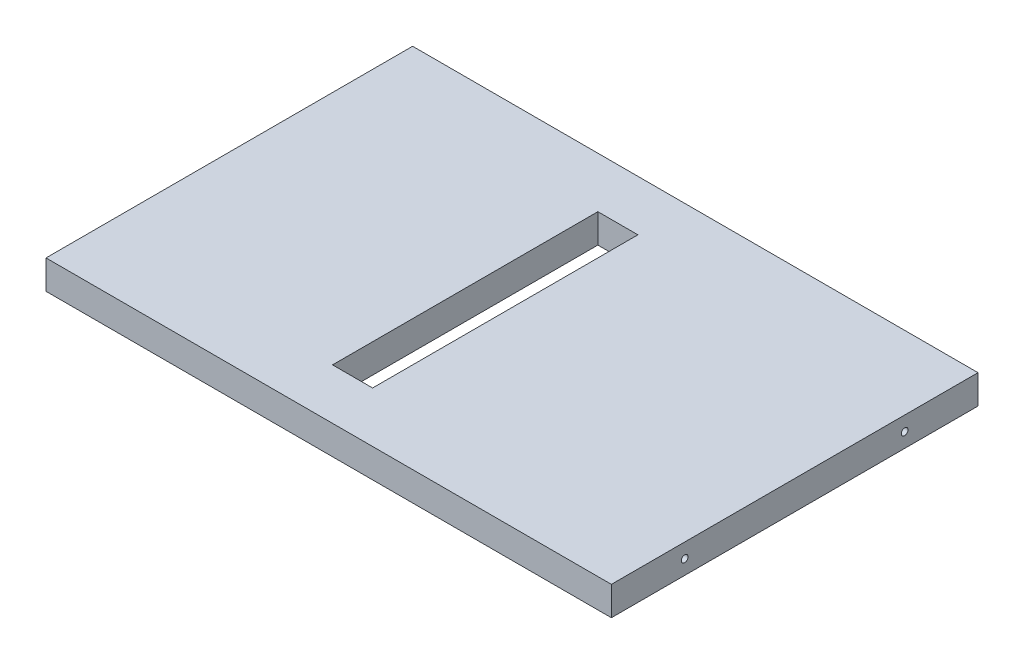
from build123d import *

# Parameters (mm, degrees)
SKETCH_1_W          = 58.6
SKETCH_1_H          = 38
EXTRUDE_1_DEPTH     = 3
SKETCH_2_W          = 4.15
SKETCH_2_H          = 27.5
CUT_EXTRUDE_1_DEPTH = 36.049821683
SKETCH_3_R          = 0.35
CUT_EXTRUDE_2_DEPTH = 3


with BuildPart() as part:
    # 草图1 → 凸台-拉伸1 (new body)
    with BuildSketch(Plane(origin=(0, 0, 0), x_dir=(1, 0, 0), z_dir=(0, 1, 0))):
        Rectangle(SKETCH_1_W, SKETCH_1_H)
    extrude(amount=EXTRUDE_1_DEPTH)

    # 草图2 → 切除-拉伸1 (cut, through all)
    with BuildSketch(Plane.XZ):
        with Locations((-2.775, 0)):
            Rectangle(SKETCH_2_W, SKETCH_2_H)
    extrude(amount=-CUT_EXTRUDE_1_DEPTH, mode=Mode.SUBTRACT)

    # 草图3 → 切除-拉伸2 (cut)
    with BuildSketch(Plane(origin=(29.3, 0, 0), x_dir=(0, 0, -1), z_dir=(1, 0, 0))):
        with Locations((-11.4, 1.5)):
            Circle(SKETCH_3_R)
        with Locations((11.4, 1.5)):
            Circle(SKETCH_3_R)
    extrude(amount=-CUT_EXTRUDE_2_DEPTH, mode=Mode.SUBTRACT)


solid = part.part
